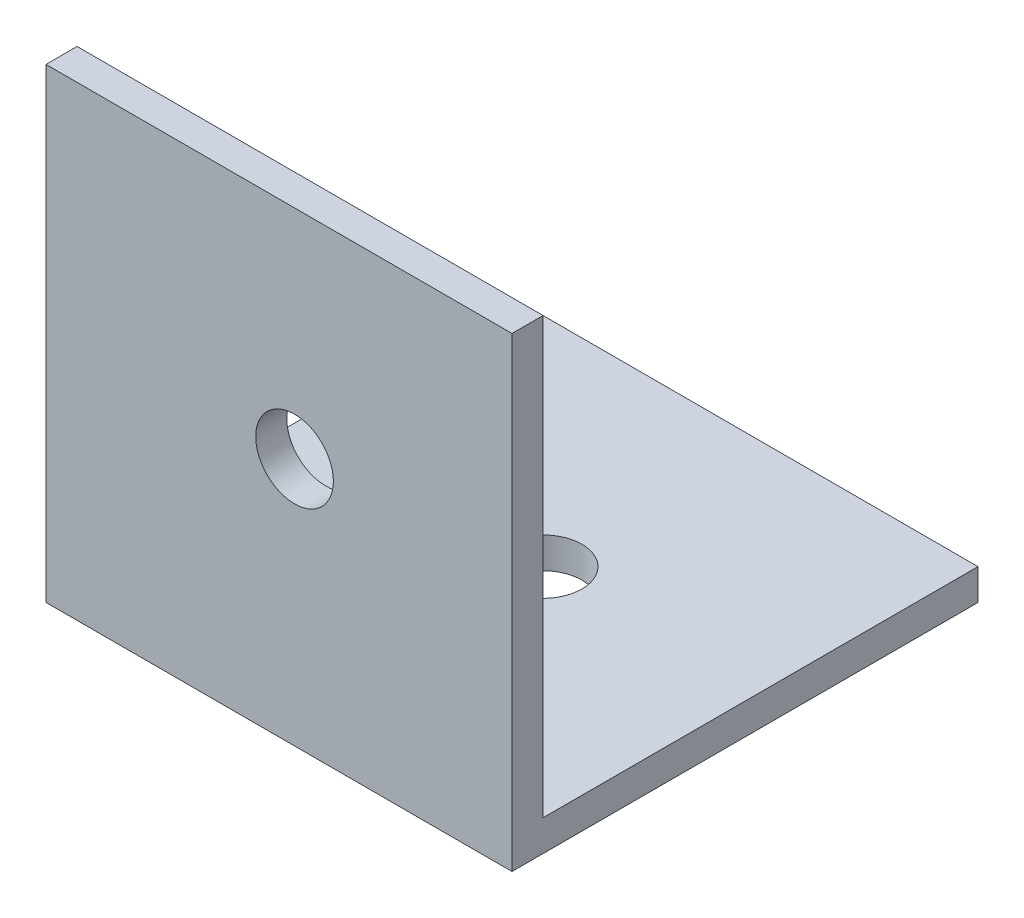
from build123d import *

# Parameters (mm, degrees)
SKETCH_1_W      = 15
SKETCH_1_H      = 15
EXTRUDE_1_DEPTH = 1
SKETCH_2_W      = 15
SKETCH_2_H      = 1
EXTRUDE_2_DEPTH = 15
M3X0_5_1_D      = 2.5
M3X0_5_2_D      = 2.5


with BuildPart() as part:
    # ｽｹｯﾁ1 → ﾎﾞｽ - 押し出し1 (new body)
    with BuildSketch(Plane.XY):
        with Locations((7.5, 7.5)):
            Rectangle(SKETCH_1_W, SKETCH_1_H)
    extrude(amount=EXTRUDE_1_DEPTH)

    # ｽｹｯﾁ2 → ﾎﾞｽ - 押し出し2 (add)
    with BuildSketch(Plane.XY.offset(1)):
        with Locations((7.5, 0.5)):
            Rectangle(SKETCH_2_W, SKETCH_2_H)
    extrude(amount=-EXTRUDE_2_DEPTH)

    # M3x0.5 ねじ穴1 (through all)
    with Locations(Plane.XY.offset(1)):
        with Locations((8, 8)):
            Hole(M3X0_5_1_D / 2)

    # M3x0.5 ねじ穴2 (through all)
    with Locations(Plane(origin=(0, 0, 0), x_dir=(-1, 0, 0), z_dir=(0, -1, 0))):
        with Locations((-8, 7)):
            Hole(M3X0_5_2_D / 2)


solid = part.part
